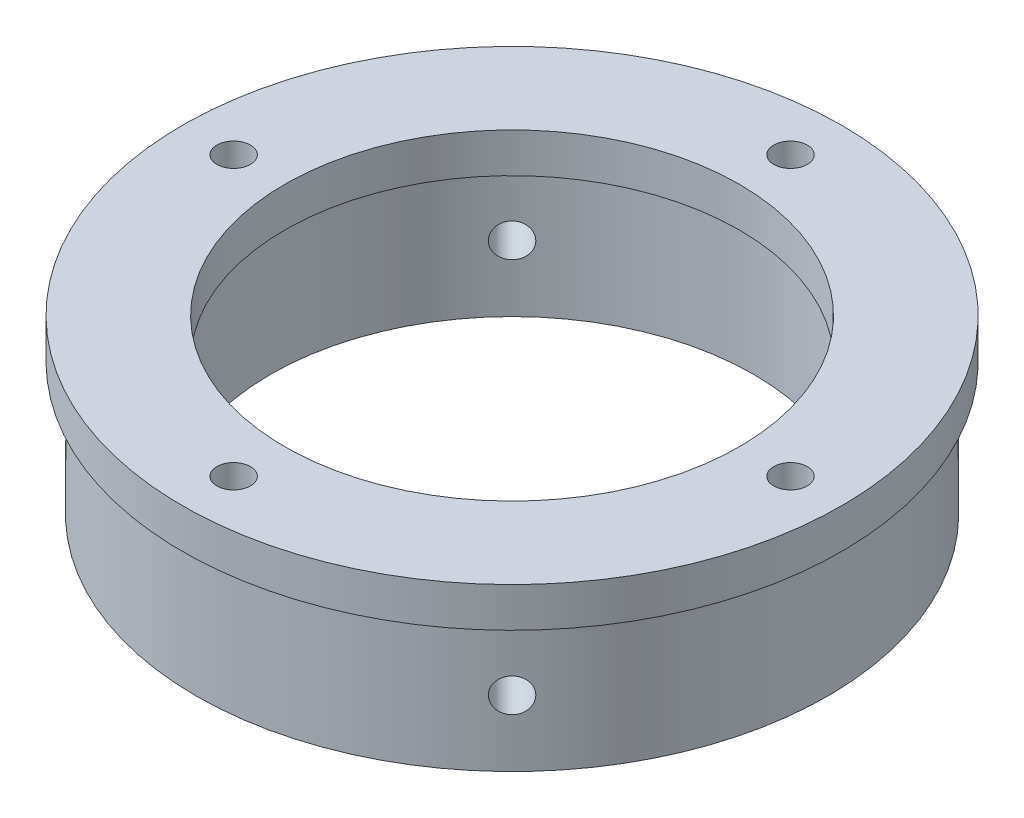
from build123d import *

# Parameters (mm, degrees)
SKETCH1_R           = 37.973
SKETCH1_R_2         = 29.0322
BOSS_EXTRUDE1_DEPTH = 15.875
SKETCH3_R           = 39.624
SKETCH3_R_2         = 27.3304
BOSS_EXTRUDE2_DEPTH = 4.7625
SKETCH4_R           = 2.0193
CUT_EXTRUDE1_DEPTH  = 38.5445
CIRPATTERN2_COUNT   = 4
SKETCH5_R           = 2.0193
CUT_EXTRUDE2_DEPTH  = 52.2605
CIRPATTERN3_COUNT   = 4


with BuildPart() as part:
    # Sketch1 → Boss-Extrude1 (new body)
    with BuildSketch(Plane(origin=(0, 0, 0), x_dir=(1, 0, 0), z_dir=(0, 1, 0))):
        with Locations(Location((0, 0, 0), (0, 0, 270))):
            Circle(SKETCH1_R)
        with Locations(Location((0, 0, 0), (0, 0, 270))):
            Circle(SKETCH1_R_2, mode=Mode.SUBTRACT)
    extrude(amount=BOSS_EXTRUDE1_DEPTH)

    # Sketch3 → Boss-Extrude2 (add)
    with BuildSketch(Plane(origin=(0, 15.875, 0), x_dir=(1, 0, 0), z_dir=(0, 1, 0))):
        with Locations(Location((0, 0, 0), (0, 0, 90))):
            Circle(SKETCH3_R)
        with Locations(Location((0, 0, 0), (0, 0, 90))):
            Circle(SKETCH3_R_2, mode=Mode.SUBTRACT)
    extrude(amount=BOSS_EXTRUDE2_DEPTH)

    # Sketch4 → Cut-Extrude1 (cut)
    with BuildSketch(Plane(origin=(0, 20.6375, 0), x_dir=(1, 0, 0), z_dir=(0, 1, 0))):
        with Locations(Location((33.4772, 0, 0), (0, 0, 270))):
            Circle(SKETCH4_R)
    cut_extrude1 = extrude(amount=-CUT_EXTRUDE1_DEPTH, mode=Mode.SUBTRACT)

    # CirPattern2: Cut-Extrude1 ×4 about axis
    cirpattern2_axis = Axis((0, 0, 0), (0, 1, 0))
    for i in range(1, CIRPATTERN2_COUNT):
        add(cut_extrude1.rotate(cirpattern2_axis, i * 360 / CIRPATTERN2_COUNT), mode=Mode.SUBTRACT)

    # Sketch5 → Cut-Extrude2 (cut)
    with BuildSketch(Plane(origin=(0, 0, 0), x_dir=(-0.7071067811865477, 0, -0.7071067811865475), z_dir=(0.7071067811865475, 0, -0.7071067811865477))):
        with Locations((0, 7.9375)):
            Circle(SKETCH5_R)
    cut_extrude2 = extrude(amount=-CUT_EXTRUDE2_DEPTH, mode=Mode.SUBTRACT)

    # CirPattern3: Cut-Extrude2 ×4 about axis
    cirpattern3_axis = Axis((0, 15.875, 0), (0, -1, 0))
    for i in range(1, CIRPATTERN3_COUNT):
        add(cut_extrude2.rotate(cirpattern3_axis, i * 360 / CIRPATTERN3_COUNT), mode=Mode.SUBTRACT)


solid = part.part
